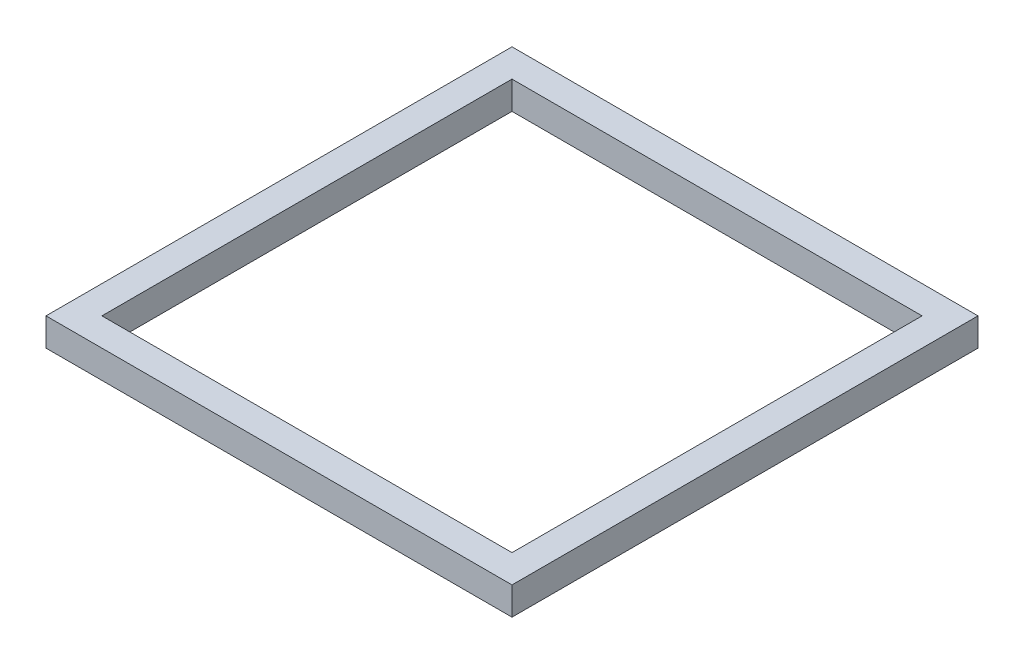
from build123d import *

# Parameters (mm, degrees)
SKETCH1_W           = 500
SKETCH1_H           = 500
SKETCH1_W_2         = 440
SKETCH1_H_2         = 440
BOSS_EXTRUDE1_DEPTH = 30


with BuildPart() as part:
    # Sketch1 → Boss-Extrude1 (new body)
    with BuildSketch(Plane(origin=(0, 0, 0), x_dir=(1, 0, 0), z_dir=(0, 1, 0))):
        Rectangle(SKETCH1_W, SKETCH1_H)
        Rectangle(SKETCH1_W_2, SKETCH1_H_2, mode=Mode.SUBTRACT)
    extrude(amount=BOSS_EXTRUDE1_DEPTH)


solid = part.part
